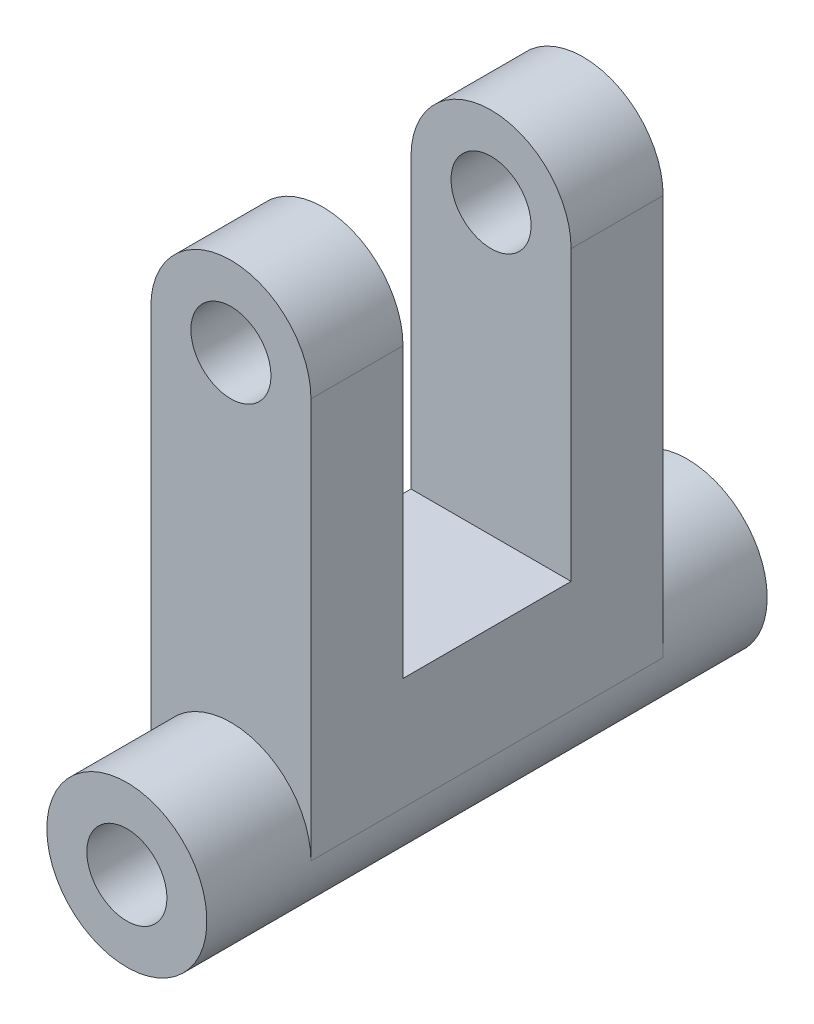
from build123d import *

# Parameters (mm, degrees)
BOSS_EXTRUDE1_DEPTH = 5.75
SKETCH2_R           = 2.5
BOSS_EXTRUDE2_DEPTH = 10.5
BOSS_EXTRUDE3_DEPTH = 16.25
SKETCH4_R           = 5
SKETCH4_R_2         = 2.5
BOSS_EXTRUDE5_DEPTH = 8.5
SKETCH5_R           = 2.5
BOSS_EXTRUDE6_DEPTH = 16.25
BOSS_EXTRUDE7_START = 8.5
SKETCH6_R           = 5
BOSS_EXTRUDE7_DEPTH = 8.5
BOSS_EXTRUDE8_START = 8
SKETCH7_R           = 2.5
BOSS_EXTRUDE8_DEPTH = 8
SKETCH8_W           = 10.5
SKETCH8_H           = 5
CUT_EXTRUDE2_DEPTH  = 20
SKETCH9_R           = 2.5
BOSS_EXTRUDE9_DEPTH = 22
SKETCH10_R          = 2.5
CUT_EXTRUDE3_DEPTH  = 55
CUT_EXTRUDE4_START  = -22
CUT_EXTRUDE4_DEPTH  = 22
SKETCH12_W          = 1
SKETCH12_H          = 5
CUT_EXTRUDE5_DEPTH  = 10
SKETCH13_W          = 1
SKETCH13_H          = 10.672821352
SKETCH13_H_2        = 10
CUT_EXTRUDE7_DEPTH  = 10


with BuildPart() as part:
    # Sketch1 → Boss-Extrude1 (new body)
    with BuildSketch(Plane.XY):
        with BuildLine():
            ThreePointArc((-5, 0), (0, -5), (5, 0))
            Line((5, 0), (5, 25))
            ThreePointArc((5, 25), (0, 30), (-5, 25))
            Line((-5, 25), (-5, 0))
        make_face()
    extrude(amount=BOSS_EXTRUDE1_DEPTH)

    # Sketch2 → Boss-Extrude2 (add)
    with BuildSketch(Plane.XY.offset(5.75)):
        with Locations(Location((0, 25.008620985, 0), (0, 0, 180))):
            Circle(SKETCH2_R)
    extrude(amount=BOSS_EXTRUDE2_DEPTH)

    # Sketch3 → Boss-Extrude3 (add)
    with BuildSketch(Plane.XY.offset(5.75)):
        with BuildLine():
            Line((5, 0), (5, 25))
            ThreePointArc((5, 25), (0, 30), (-5, 25))
            Line((-5, 25), (-5, 0))
            ThreePointArc((-5, 0), (0, -5), (5, 0))
        make_face()
    extrude(amount=BOSS_EXTRUDE3_DEPTH)

    # Sketch4 → Boss-Extrude5 (add)
    with BuildSketch(Plane.XY.offset(22)):
        Circle(SKETCH4_R)
        Circle(SKETCH4_R_2, mode=Mode.SUBTRACT)
    extrude(amount=BOSS_EXTRUDE5_DEPTH)

    # Sketch5 → Boss-Extrude6 (add)
    with BuildSketch(Plane.XY.offset(22)):
        Circle(SKETCH5_R)
    extrude(amount=BOSS_EXTRUDE6_DEPTH)

    # Sketch6 → Boss-Extrude7 (add)
    with BuildSketch(Plane(origin=(0, 0, 0), x_dir=(-1, 0, 0), z_dir=(0, 0, -1)).offset(BOSS_EXTRUDE7_START)):
        Circle(SKETCH6_R)
    extrude(amount=-BOSS_EXTRUDE7_DEPTH)

    # Sketch7 → Boss-Extrude8 (add)
    with BuildSketch(Plane(origin=(0, 0, -8.5), x_dir=(-1, 0, 0), z_dir=(0, 0, -1)).offset(BOSS_EXTRUDE8_START)):
        with Locations(Location((0, 0, 0), (0, 0, 180))):
            Circle(SKETCH7_R)
    extrude(amount=-BOSS_EXTRUDE8_DEPTH)

    # Sketch8 → Cut-Extrude2 (cut)
    with BuildSketch(Plane.ZY.offset(5)):
        Polygon((16.25, 25), (5.75, 25), (5.75, 7.741676668), (5.75, 7), (16.25, 7), (16.25, 7.741676668), align=None)
        with Locations((11, 27.5)):
            Rectangle(SKETCH8_W, SKETCH8_H)
    extrude(amount=-CUT_EXTRUDE2_DEPTH, mode=Mode.SUBTRACT)

    # Sketch9 → Boss-Extrude9 (add)
    with BuildSketch(Plane.XY.offset(22)):
        with Locations(Location((0, 25, 0), (0, 0, 90))):
            Circle(SKETCH9_R)
    extrude(amount=-BOSS_EXTRUDE9_DEPTH)

    # Sketch10 → Cut-Extrude3 (cut)
    with BuildSketch(Plane(origin=(0, 0, -16.5), x_dir=(-1, 0, 0), z_dir=(0, 0, -1))):
        Circle(SKETCH10_R)
    extrude(amount=-CUT_EXTRUDE3_DEPTH, mode=Mode.SUBTRACT)

    # Sketch11 → Cut-Extrude4 (cut)
    with BuildSketch(Plane(origin=(0, 0, 0), x_dir=(-1, 0, 0), z_dir=(0, 0, -1)).offset(CUT_EXTRUDE4_START)):
        with BuildLine():
            ThreePointArc((-2.5, 25), (0, 22.5), (2.5, 25))
            Line((2.5, 25), (-2.5, 25))
        make_face()
        with BuildLine():
            Line((-2.5, 25), (2.5, 25))
            ThreePointArc((2.5, 25), (0, 27.5), (-2.5, 25))
        make_face()
    extrude(amount=CUT_EXTRUDE4_DEPTH, mode=Mode.SUBTRACT)

    # Sketch12 → Cut-Extrude5 (cut, symmetric)
    with BuildSketch(Plane(origin=(0, 0, 0), x_dir=(0, 0, -1), z_dir=(1, 0, 0))):
        with Locations((8, 2.5)):
            Rectangle(SKETCH12_W, SKETCH12_H)
        with Locations((8, -2.5)):
            Rectangle(SKETCH12_W, SKETCH12_H)
        with Locations((-30, 2.5)):
            Rectangle(SKETCH12_W, SKETCH12_H)
        with Locations((-30, -2.5)):
            Rectangle(SKETCH12_W, SKETCH12_H)
    extrude(amount=CUT_EXTRUDE5_DEPTH, both=True, mode=Mode.SUBTRACT)

    # Sketch13 → Cut-Extrude7 (cut)
    with BuildSketch(Plane(origin=(5, 0, 0), x_dir=(0, 0, -1), z_dir=(1, 0, 0))):
        with Locations((7, 0.336410676)):
            Rectangle(SKETCH13_W, SKETCH13_H)
        with Locations((-29, 0)):
            Rectangle(SKETCH13_W, SKETCH13_H_2)
    extrude(amount=-CUT_EXTRUDE7_DEPTH, mode=Mode.SUBTRACT)


solid = part.part
